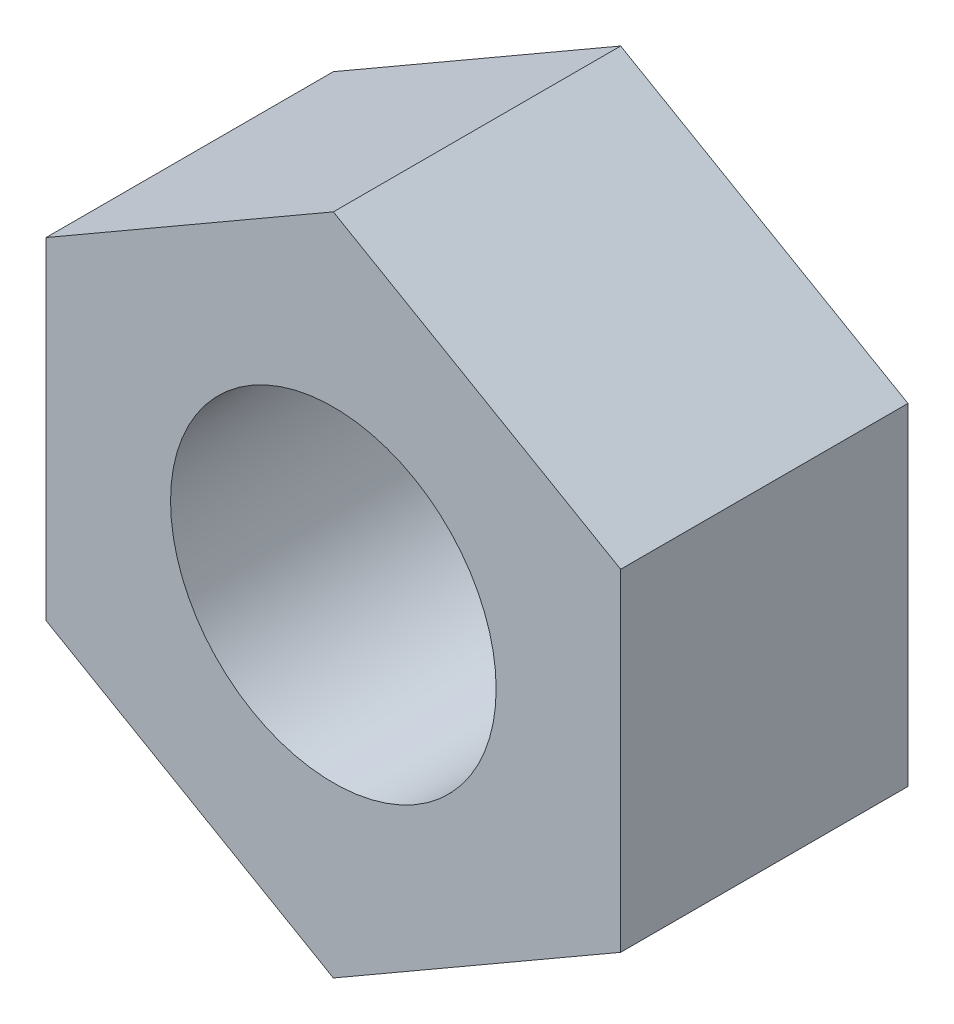
from build123d import *

# Parameters (mm, degrees)
EXTRUDE_1_DEPTH    = 6
HOLE_WIZARD_M8_2_D = 6.8


with BuildPart() as part:
    # 草图1 → 凸台-拉伸1 (new body)
    with BuildSketch(Plane.XY):
        Polygon((6, -3.464101615), (6, 3.464101615), (0, 6.92820323), (-6, 3.464101615), (-6, -3.464101615), (0, -6.92820323), align=None)
    extrude(amount=EXTRUDE_1_DEPTH)

    # M8 螺纹孔2 (through all)
    with Locations(Plane.XY.offset(6)):
        with Locations((0, 0)):
            Hole(HOLE_WIZARD_M8_2_D / 2)


solid = part.part
